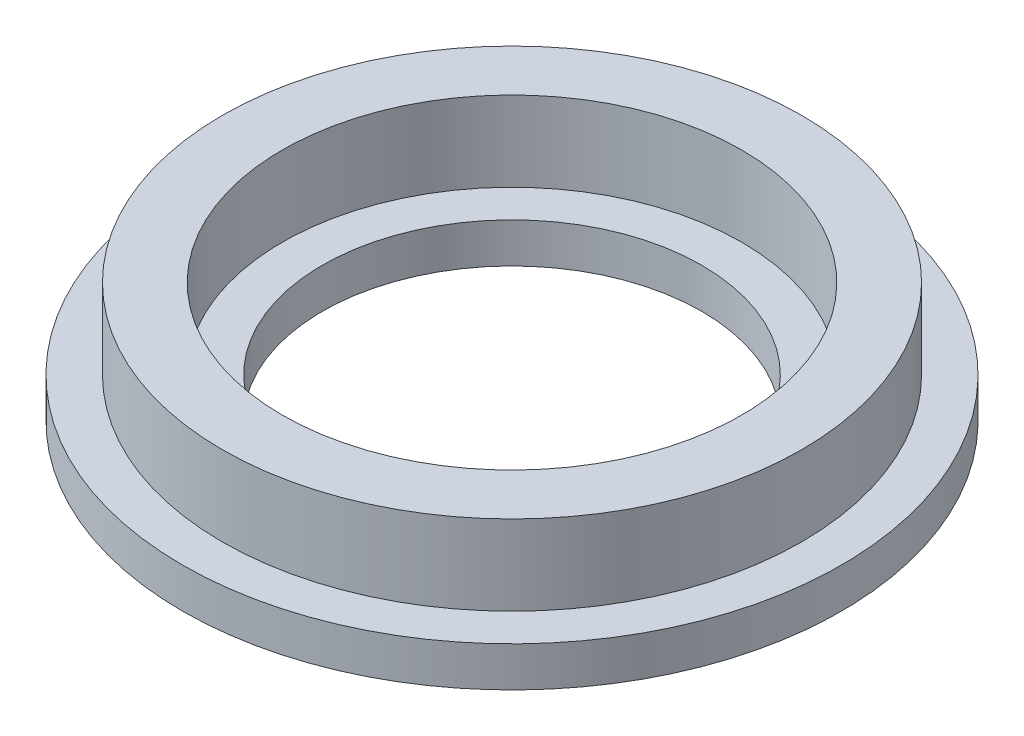
from build123d import *


with BuildPart() as part:
    # Skizze1 → Rotation1 (revolve)
    with BuildSketch(Plane.XY, mode=Mode.PRIVATE) as rotation1_sk:
        Polygon((-9.5, 0), (-16.5, 0), (-16.5, 2), (-14.5, 2), (-14.5, 6), (-11.5, 6), (-11.5, 2), (-9.5, 2), align=None)
    revolve(rotation1_sk.sketch.rotate(Axis((0, 0, 0), (0, 1, 0)), 270), axis=Axis((0, 0, 0), (0, 1, 0)))


solid = part.part
